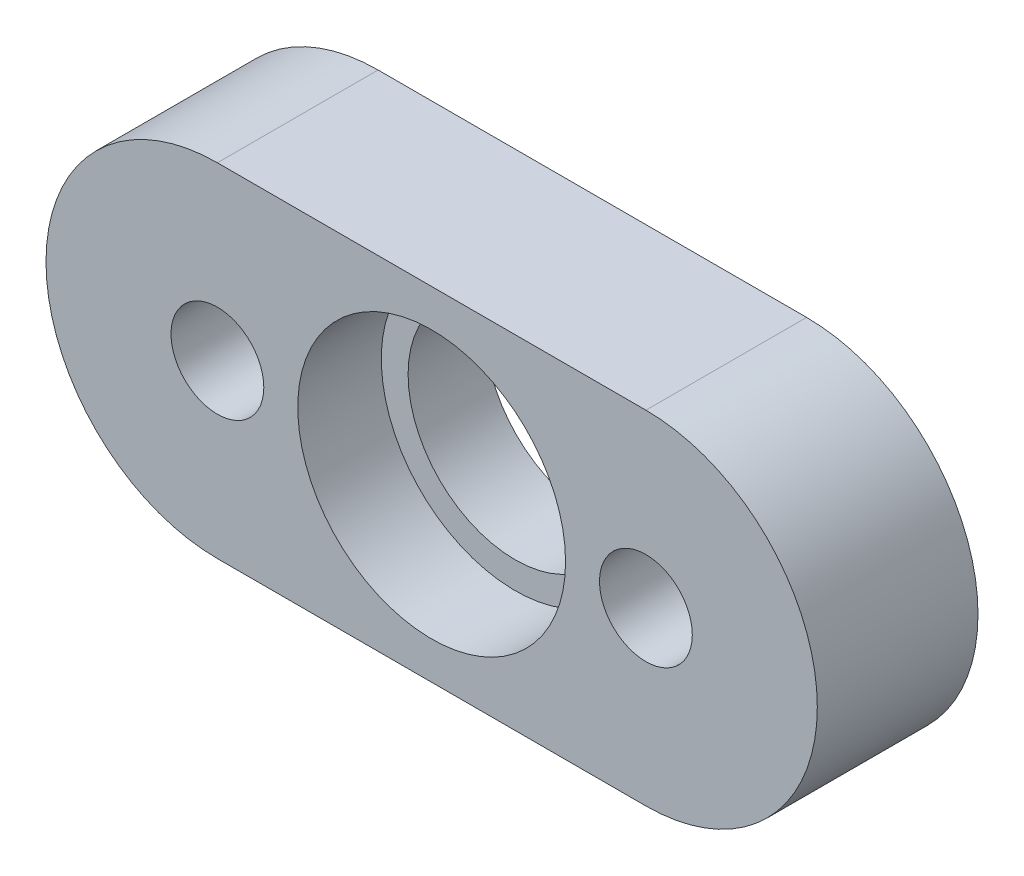
from build123d import *

# Parameters (mm, degrees)
BOSS_EXTRUDE5_DEPTH = 9.525
SKETCH5_R           = 7.9375
CUT_EXTRUDE3_DEPTH  = 4.953
SKETCH6_R           = 6.35
SKETCH6_R_2         = 2.75
CUT_EXTRUDE4_DEPTH  = 27.768093414


with BuildPart() as part:
    # Sketch2 → Boss-Extrude5 (new body)
    with BuildSketch(Plane.XY):
        with BuildLine():
            Line((-12.7, 10.16), (12.7, 10.16))
            ThreePointArc((12.7, 10.16), (22.86, 0), (12.7, -10.16))
            Line((12.7, -10.16), (-12.7, -10.16))
            ThreePointArc((-12.7, -10.16), (-22.86, 0), (-12.7, 10.16))
        make_face()
    extrude(amount=BOSS_EXTRUDE5_DEPTH)

    # Sketch5 → Cut-Extrude3 (cut)
    with BuildSketch(Plane.XY.offset(9.525)):
        Circle(SKETCH5_R)
    extrude(amount=-CUT_EXTRUDE3_DEPTH, mode=Mode.SUBTRACT)

    # Sketch6 → Cut-Extrude4 (cut, through all)
    with BuildSketch(Plane.XY.offset(9.525)):
        Circle(SKETCH6_R)
        with Locations((-12.7, 0)):
            Circle(SKETCH6_R_2)
        with Locations((12.7, 0)):
            Circle(SKETCH6_R_2)
    extrude(amount=-CUT_EXTRUDE4_DEPTH, mode=Mode.SUBTRACT)


solid = part.part
